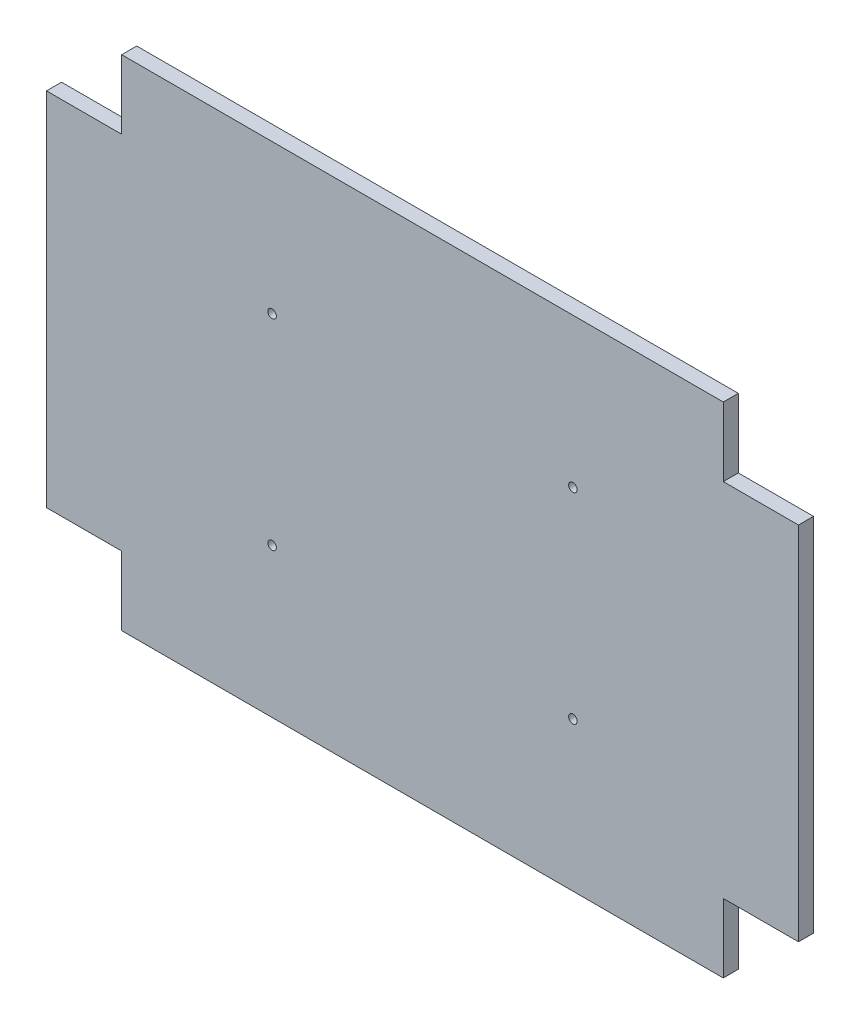
from build123d import *

# Parameters (mm, degrees)
BOSS_EXTRUDE1_DEPTH  = 6
M3_CLEARANCE_HOLE1_D = 3.4


with BuildPart() as part:
    # Sketch1 → Boss-Extrude1 (new body)
    with BuildSketch(Plane.XY):
        Polygon((120, 72), (150, 72), (150, -72), (120, -72), (120, -99.5), (-120, -99.5), (-120, -72), (-150, -72), (-150, 72), (-120, 72), (-120, 99.5), (120, 99.5), align=None)
    extrude(amount=BOSS_EXTRUDE1_DEPTH)

    # M3 Clearance Hole1 (through all)
    with Locations(Plane(origin=(-60, 40, 6), x_dir=(1, 0, 0), z_dir=(0, 0, 1))):
        with Locations((0, 0), (0, -80), (120, -80), (120, 0)):
            Hole(M3_CLEARANCE_HOLE1_D / 2)


solid = part.part
